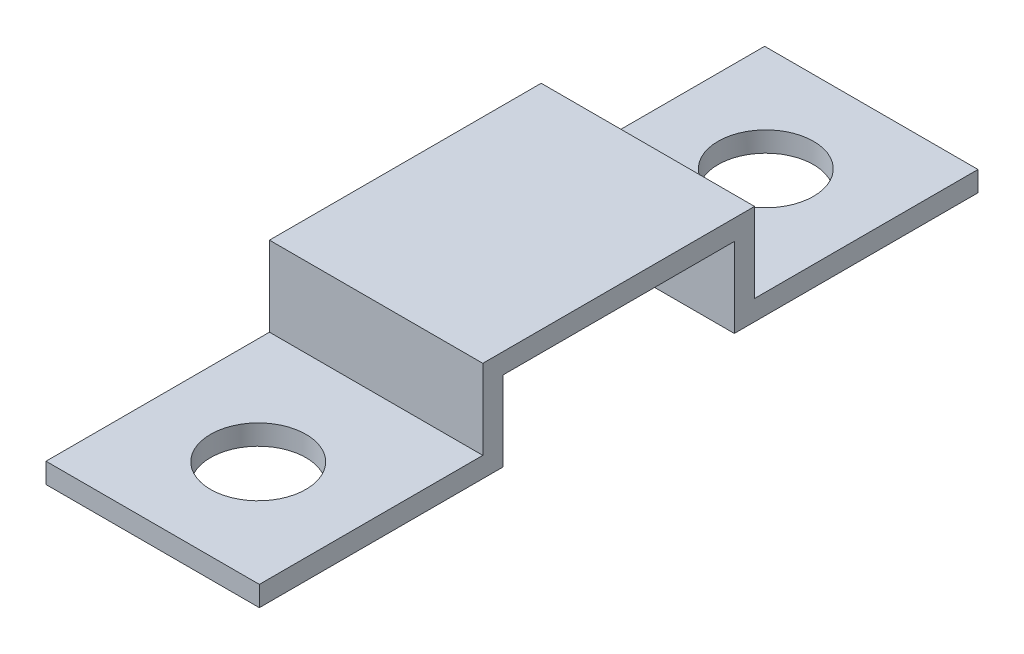
from build123d import *

# Parameters (mm, degrees)
EXTRUDE_5_DEPTH     = 19
SKETCH_6_R          = 4.25
CUT_EXTRUDE_1_DEPTH = 19


with BuildPart() as part:
    # 草图5 → 凸台-拉伸5 (new body)
    with BuildSketch(Plane(origin=(0, 0, 0), x_dir=(0, 0, -1), z_dir=(1, 0, 0))):
        Polygon((12.1, 0), (-12.1, 0), (-12.1, -7.1), (-32, -7.1), (-32, -8.9), (-10.3, -8.9), (-10.3, -1.8), (10.3, -1.8), (10.3, -8.9), (32, -8.9), (32, -7.1), (12.1, -7.1), align=None)
    extrude(amount=EXTRUDE_5_DEPTH)

    # 草图6 → 切除-拉伸1 (cut)
    with BuildSketch(Plane(origin=(0, -7.1, 0), x_dir=(1, 0, 0), z_dir=(0, 1, 0))):
        with Locations(Location((9.5, -22.6, 0), (0, 0, 270))):
            Circle(SKETCH_6_R)
        with Locations(Location((9.5, 22.6, 0), (0, 0, 270))):
            Circle(SKETCH_6_R)
    extrude(amount=-CUT_EXTRUDE_1_DEPTH, mode=Mode.SUBTRACT)


solid = part.part
